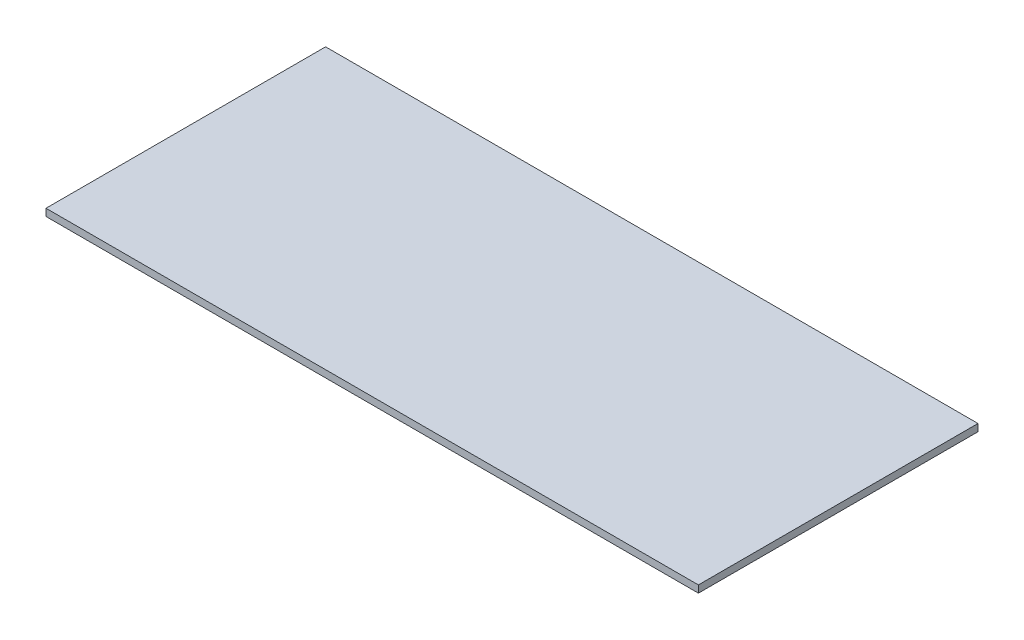
from build123d import *

# Parameters (mm, degrees)
SKETCH1_W           = 182
SKETCH1_H           = 78
BOSS_EXTRUDE1_DEPTH = 2


with BuildPart() as part:
    # Sketch1 → Boss-Extrude1 (new body)
    with BuildSketch(Plane(origin=(0, 0, 0), x_dir=(1, 0, 0), z_dir=(0, 1, 0))):
        with Locations((91, 39)):
            Rectangle(SKETCH1_W, SKETCH1_H)
    extrude(amount=BOSS_EXTRUDE1_DEPTH)


solid = part.part
